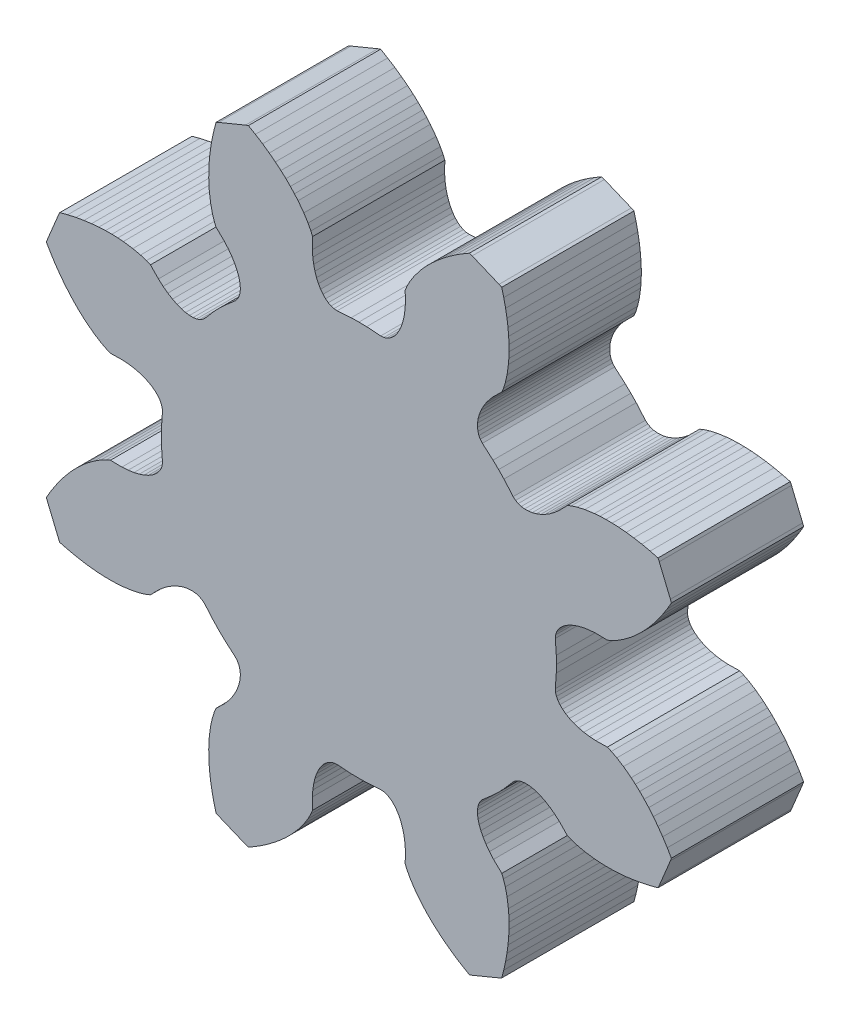
from build123d import *

# Parameters (mm, degrees)
BOSS_EXTRUDE1_DEPTH = 5.08


with BuildPart() as part:
    # Sketch1 → Boss-Extrude1 (new body)
    with BuildSketch(Plane.XY):
        Polygon((-25.692059683, 14.61520926), (-25.762417683, 14.93626526), (-25.816011683, 15.24233526), (-25.854619683, 15.53443526), (-25.879511683, 15.81129526), (-25.891957683, 16.07164526), (-25.893481683, 16.31573926), (-25.884845683, 16.54281526), (-25.869859683, 16.75236526), (-25.817535683, 17.11888726), (-25.751241683, 17.41530526), (-25.679613683, 17.64136526), (-25.616367683, 17.79706726), (-25.299375683, 18.10288326), (-25.142403683, 18.28347726), (-25.008545683, 18.46407126), (-24.898309683, 18.64339526), (-24.811441683, 18.81687726), (-24.746925683, 18.98350126), (-24.705269683, 19.14453726), (-24.683425683, 19.29490526), (-24.681901683, 19.43714526), (-24.701459683, 19.56516126), (-24.737019683, 19.68098526), (-24.790867683, 19.78131526), (-24.870623683, 19.87656526), (-25.278547683, 20.23089526), (-25.492161683, 20.43612726), (-25.697647683, 20.64948726), (-26.051723683, 21.05893526), (-26.146719683, 21.13742126), (-26.247557683, 21.19101526), (-26.363381683, 21.22860726), (-26.492667683, 21.24613326), (-26.633129683, 21.24511726), (-26.784767683, 21.22428926), (-26.944533683, 21.18161726), (-27.112935683, 21.11659326), (-27.286417683, 21.02997926), (-27.464217683, 20.91974326), (-27.644811683, 20.78740926), (-27.826675683, 20.62865926), (-28.132491683, 20.31344526), (-28.288447683, 20.24842126), (-28.514253683, 20.17831726), (-28.809147683, 20.11100726), (-29.175669683, 20.05969926), (-29.385219683, 20.04318926), (-29.614073683, 20.03506126), (-29.857913683, 20.03633126), (-30.116739683, 20.04877726), (-30.395123683, 20.07341526), (-30.686207683, 20.11380126), (-30.993547683, 20.16739526), (-31.313079683, 20.23749926), (-31.614831683, 20.31623926), (-31.664361683, 20.41809326), (-32.093113683, 21.45288926), (-32.130197683, 21.55753726), (-31.971701683, 21.82779326), (-31.795425683, 22.10338326), (-31.616101683, 22.35839926), (-31.438301683, 22.59258726), (-31.259485683, 22.80620126), (-31.084479683, 22.99898726), (-30.913283683, 23.17272326), (-30.746659683, 23.32715526), (-30.586639683, 23.46507726), (-30.290729683, 23.68808926), (-30.034189683, 23.84937926), (-29.824639683, 23.95834526), (-29.669191683, 24.02311526), (-29.229517683, 24.01625726), (-28.989741683, 24.03276726), (-28.766475683, 24.06578726), (-28.563783683, 24.11379326), (-28.379379683, 24.17602326), (-28.215295683, 24.24892126), (-28.071785683, 24.33197926), (-27.949357683, 24.42392726), (-27.850297683, 24.52349526), (-27.771557683, 24.62636526), (-27.715169683, 24.73406126), (-27.681895683, 24.84455126), (-27.670973683, 24.96697926), (-27.709581683, 25.50596726), (-27.715169683, 25.80213126), (-27.709581683, 26.09956526), (-27.670973683, 26.63880726), (-27.681895683, 26.76123526), (-27.715169683, 26.87147126), (-27.771557683, 26.97865926), (-27.850297683, 27.08203726), (-27.949357683, 27.18160526), (-28.071785683, 27.27228326), (-28.215295683, 27.35661126), (-28.379379683, 27.42950926), (-28.563783683, 27.49173926), (-28.766475683, 27.53974526), (-28.989741683, 27.57276526), (-29.229517683, 27.58952926), (-29.669191683, 27.58241726), (-29.824639683, 27.64718726), (-30.034189683, 27.75640726), (-30.290729683, 27.91744326), (-30.586639683, 28.14045526), (-30.746659683, 28.27837726), (-30.913283683, 28.43280926), (-31.084479683, 28.60654526), (-31.259485683, 28.79933126), (-31.438301683, 29.01294526), (-31.616101683, 29.24713326), (-31.795425683, 29.50214926), (-31.971701683, 29.77773926), (-32.130197683, 30.04799526), (-32.093113683, 30.15365926), (-31.664361683, 31.18870926), (-31.614831683, 31.28929326), (-31.313079683, 31.36803326), (-30.993547683, 31.43813726), (-30.686207683, 31.49198526), (-30.395123683, 31.53059326), (-30.116739683, 31.55675526), (-29.857913683, 31.56920126), (-29.614073683, 31.57047126), (-29.385219683, 31.56234326), (-29.175669683, 31.54583326), (-28.809147683, 31.49477926), (-28.514253683, 31.42721526), (-28.288447683, 31.35711126), (-28.132491683, 31.29208726), (-27.826675683, 30.97636526), (-27.644811683, 30.81812326), (-27.464217683, 30.68426526), (-27.286417683, 30.57580726), (-27.112935683, 30.48893926), (-26.944533683, 30.42391526), (-26.784767683, 30.38124326), (-26.633129683, 30.36041526), (-26.492667683, 30.35914526), (-26.363381683, 30.37717926), (-26.247557683, 30.41451726), (-26.146719683, 30.46811126), (-26.051723683, 30.54685126), (-25.697647683, 30.95604526), (-25.492161683, 31.16940526), (-25.278547683, 31.37463726), (-24.870623683, 31.72896726), (-24.790867683, 31.82421726), (-24.737019683, 31.92480126), (-24.701459683, 32.04037126), (-24.681901683, 32.16838726), (-24.683425683, 32.30935726), (-24.705269683, 32.46099526), (-24.746925683, 32.62203126), (-24.811441683, 32.78865526), (-24.898309683, 32.96213726), (-25.008545683, 33.13993726), (-25.142403683, 33.32205526), (-25.299375683, 33.50264926), (-25.616367683, 33.80846526), (-25.679613683, 33.96416726), (-25.751241683, 34.19022726), (-25.817535683, 34.48512126), (-25.869859683, 34.85316726), (-25.884845683, 35.06271726), (-25.893481683, 35.28979326), (-25.891957683, 35.53363326), (-25.879511683, 35.79423726), (-25.854619683, 36.07135126), (-25.816011683, 36.36345126), (-25.762417683, 36.66926726), (-25.692059683, 36.99032326), (-25.612303683, 37.29232926), (-25.511719683, 37.34058926), (-24.476669683, 37.76883326), (-24.370497683, 37.80617126), (-24.102019683, 37.64919926), (-23.824651683, 37.47292326), (-23.569889683, 37.29359926), (-23.337225683, 37.11452926), (-23.121833683, 36.93672926), (-22.929047683, 36.76172326), (-22.756835683, 36.58951126), (-22.601387683, 36.42263326), (-22.463211683, 36.26286726), (-22.241469683, 35.96797326), (-22.078909683, 35.71143326), (-21.970197683, 35.50086726), (-21.905173683, 35.34643526), (-21.912285683, 34.90523726), (-21.895775683, 34.66571526), (-21.862501683, 34.44397326), (-21.814241683, 34.23975726), (-21.752011683, 34.05662326), (-21.679113683, 33.89253926), (-21.596563683, 33.74928326), (-21.504107683, 33.62660126), (-21.406317683, 33.52601726), (-21.301669683, 33.44727726), (-21.193973683, 33.39215926), (-21.085261683, 33.35913926), (-20.961309683, 33.34821726), (-20.422575683, 33.38707926), (-20.126157683, 33.39215926), (-19.829739683, 33.38707926), (-19.289735683, 33.34821726), (-19.167053683, 33.35913926), (-19.058341683, 33.39215926), (-18.950645683, 33.44727726), (-18.845997683, 33.52601726), (-18.746683683, 33.62660126), (-18.655751683, 33.74928326), (-18.571931683, 33.89253926), (-18.498779683, 34.05662326), (-18.438073683, 34.23975726), (-18.389813683, 34.44397326), (-18.356539683, 34.66571526), (-18.339013683, 34.90523726), (-18.347141683, 35.34643526), (-18.281101683, 35.50086726), (-18.172135683, 35.71143326), (-18.010845683, 35.96797326), (-17.787579683, 36.26286726), (-17.651181683, 36.42263326), (-17.495479683, 36.58951126), (-17.321997683, 36.76172326), (-17.128957683, 36.93672926), (-16.915089683, 37.11452926), (-16.682425683, 37.29359926), (-16.427663683, 37.47292326), (-16.150295683, 37.64919926), (-15.880547683, 37.80617126), (-15.775645683, 37.76883326), (-14.742119683, 37.34058926), (-14.640011683, 37.29232926), (-14.560509683, 36.99032326), (-14.489897683, 36.66926726), (-14.436303683, 36.36345126), (-14.397695683, 36.07135126), (-14.372803683, 35.79423726), (-14.359087683, 35.53363326), (-14.357563683, 35.28979326), (-14.365945683, 35.06271726), (-14.382709683, 34.85316726), (-14.433509683, 34.48512126), (-14.501073683, 34.19022726), (-14.572701683, 33.96416726), (-14.636201683, 33.80846526), (-14.952939683, 33.50264926), (-15.109911683, 33.32205526), (-15.243769683, 33.13993726), (-15.354259683, 32.96213726), (-15.440873683, 32.78865526), (-15.504119683, 32.62203126), (-15.547045683, 32.46099526), (-15.568889683, 32.30935726), (-15.568889683, 32.16838726), (-15.551109683, 32.04037126), (-15.515295683, 31.92480126), (-15.461447683, 31.82421726), (-15.381691683, 31.72896726), (-14.973767683, 31.37463726), (-14.758629683, 31.16940526), (-14.553397683, 30.95604526), (-14.199067683, 30.54685126), (-14.105595683, 30.46811126), (-14.003741683, 30.41451726), (-13.887663683, 30.37717926), (-13.759647683, 30.35914526), (-13.619185683, 30.36041526), (-13.467547683, 30.38124326), (-13.307781683, 30.42391526), (-13.139379683, 30.48893926), (-12.965897683, 30.57580726), (-12.788097683, 30.68426526), (-12.607757683, 30.81812326), (-12.425639683, 30.97636526), (-12.119823683, 31.29208726), (-11.963867683, 31.35711126), (-11.738061683, 31.42721526), (-11.443167683, 31.49477926), (-11.076645683, 31.54583326), (-10.865825683, 31.56234326), (-10.638241683, 31.57047126), (-10.394401683, 31.56920126), (-10.134051683, 31.55675526), (-9.857191683, 31.53059326), (-9.565091683, 31.49198526), (-9.258767683, 31.43813726), (-8.937711683, 31.36803326), (-8.636213683, 31.28929326), (-8.587953683, 31.18870926), (-8.159201683, 30.15365926), (-8.122117683, 30.04799526), (-8.279089683, 29.77773926), (-8.456889683, 29.50214926), (-8.634689683, 29.24713326), (-8.814013683, 29.01294526), (-8.992829683, 28.79933126), (-9.168089683, 28.60654526), (-9.339031683, 28.43280926), (-9.505909683, 28.27837726), (-9.665675683, 28.14045526), (-9.961839683, 27.91744326), (-10.216601683, 27.75640726), (-10.427675683, 27.64718726), (-10.583123683, 27.58241726), (-11.022797683, 27.58952926), (-11.262573683, 27.57276526), (-11.484569683, 27.53974526), (-11.688531683, 27.49173926), (-11.872935683, 27.42950926), (-12.037019683, 27.35661126), (-12.180529683, 27.27228326), (-12.301433683, 27.18160526), (-12.402017683, 27.08203726), (-12.480757683, 26.97865926), (-12.535875683, 26.87147126), (-12.570419683, 26.76123526), (-12.581341683, 26.63880726), (-12.542733683, 26.09956526), (-12.535875683, 25.80213126), (-12.542733683, 25.50596726), (-12.581341683, 24.96697926), (-12.570419683, 24.84455126), (-12.535875683, 24.73406126), (-12.480757683, 24.62636526), (-12.402017683, 24.52349526), (-12.301433683, 24.42392726), (-12.180529683, 24.33197926), (-12.037019683, 24.24892126), (-11.872935683, 24.17602326), (-11.688531683, 24.11379326), (-11.484569683, 24.06578726), (-11.262573683, 24.03276726), (-11.022797683, 24.01625726), (-10.583123683, 24.02311526), (-10.427675683, 23.95834526), (-10.216601683, 23.84937926), (-9.961839683, 23.68808926), (-9.665675683, 23.46507726), (-9.505909683, 23.32715526), (-9.339031683, 23.17272326), (-9.168089683, 22.99898726), (-8.992829683, 22.80620126), (-8.814013683, 22.59258726), (-8.634689683, 22.35839926), (-8.456889683, 22.10338326), (-8.279089683, 21.82779326), (-8.122117683, 21.55753726), (-8.159201683, 21.45288926), (-8.587953683, 20.41809326), (-8.636213683, 20.31623926), (-8.937711683, 20.23749926), (-9.258767683, 20.16739526), (-9.565091683, 20.11380126), (-9.857191683, 20.07341526), (-10.134051683, 20.04877726), (-10.394401683, 20.03633126), (-10.638241683, 20.03506126), (-10.865825683, 20.04318926), (-11.076645683, 20.05969926), (-11.443167683, 20.11100726), (-11.738061683, 20.17831726), (-11.963867683, 20.24842126), (-12.119823683, 20.31344526), (-12.425639683, 20.62865926), (-12.607757683, 20.78740926), (-12.788097683, 20.91974326), (-12.965897683, 21.02997926), (-13.139379683, 21.11659326), (-13.307781683, 21.18161726), (-13.467547683, 21.22428926), (-13.619185683, 21.24511726), (-13.759647683, 21.24613326), (-13.887663683, 21.22860726), (-14.003741683, 21.19101526), (-14.105595683, 21.13742126), (-14.199067683, 21.05893526), (-14.553397683, 20.64948726), (-14.758629683, 20.43612726), (-14.973767683, 20.23089526), (-15.381691683, 19.87656526), (-15.461447683, 19.78131526), (-15.515295683, 19.68098526), (-15.551109683, 19.56516126), (-15.568889683, 19.43714526), (-15.568889683, 19.29490526), (-15.547045683, 19.14453726), (-15.504119683, 18.98350126), (-15.440873683, 18.81687726), (-15.354259683, 18.64339526), (-15.243769683, 18.46407126), (-15.109911683, 18.28347726), (-14.952939683, 18.10288326), (-14.636201683, 17.79706726), (-14.572701683, 17.64136526), (-14.501073683, 17.41530526), (-14.433509683, 17.11888726), (-14.382709683, 16.75236526), (-14.365945683, 16.54281526), (-14.357563683, 16.31573926), (-14.359087683, 16.07164526), (-14.372803683, 15.81129526), (-14.397695683, 15.53443526), (-14.436303683, 15.24233526), (-14.489897683, 14.93626526), (-14.560509683, 14.61520926), (-14.640011683, 14.31345726), (-14.742119683, 14.26494326), (-15.775645683, 13.83669926), (-15.880547683, 13.79936126), (-16.150295683, 13.95633326), (-16.427663683, 14.13260926), (-16.682425683, 14.31193326), (-16.915089683, 14.49125726), (-17.128957683, 14.66905726), (-17.321997683, 14.84380926), (-17.495479683, 15.01602126), (-17.651181683, 15.18289926), (-17.787579683, 15.34266526), (-18.010845683, 15.63755926), (-18.172135683, 15.89409926), (-18.281101683, 16.10466526), (-18.347141683, 16.25935126), (-18.339013683, 16.70029526), (-18.356539683, 16.93981726), (-18.389813683, 17.16155926), (-18.438073683, 17.36552126), (-18.498779683, 17.54890926), (-18.571931683, 17.71299326), (-18.655751683, 17.85624926), (-18.746683683, 17.97893126), (-18.845997683, 18.07951526), (-18.950645683, 18.15673126), (-19.058341683, 18.21337326), (-19.167053683, 18.24639326), (-19.289735683, 18.25731526), (-19.829739683, 18.21870726), (-20.126157683, 18.21337326), (-20.422575683, 18.21870726), (-20.961309683, 18.25731526), (-21.085261683, 18.24639326), (-21.193973683, 18.21337326), (-21.301669683, 18.15673126), (-21.406317683, 18.07951526), (-21.504107683, 17.97893126), (-21.596563683, 17.85624926), (-21.679113683, 17.71299326), (-21.752011683, 17.54890926), (-21.814241683, 17.36552126), (-21.862501683, 17.16155926), (-21.895775683, 16.93981726), (-21.912285683, 16.70029526), (-21.905173683, 16.25935126), (-21.970197683, 16.10466526), (-22.078909683, 15.89409926), (-22.241469683, 15.63755926), (-22.463211683, 15.34266526), (-22.601387683, 15.18289926), (-22.756835683, 15.01602126), (-22.929047683, 14.84380926), (-23.121833683, 14.66905726), (-23.337225683, 14.49125726), (-23.569889683, 14.31193326), (-23.824651683, 14.13260926), (-24.102019683, 13.95633326), (-24.370497683, 13.79936126), (-24.476669683, 13.83669926), (-25.511719683, 14.26494326), (-25.612303683, 14.31345726), align=None)
    extrude(amount=BOSS_EXTRUDE1_DEPTH)


solid = part.part
